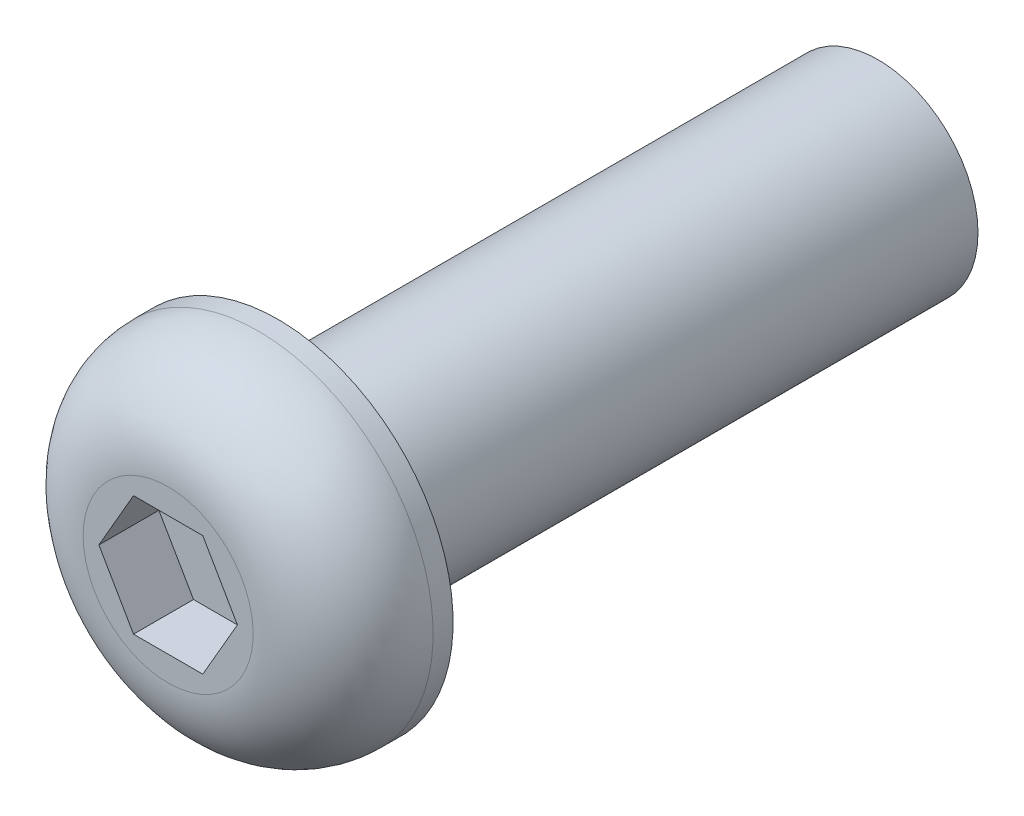
from build123d import *

# Parameters (mm, degrees)
SKETCH1_R          = 5
EXTRUDE1_DEPTH     = 30
CUT_EXTRUDE1_DEPTH = 3


with BuildPart() as part:
    # Sketch1 → Extrude1 (new body)
    with BuildSketch(Plane.XY):
        Circle(SKETCH1_R)
    extrude(amount=-EXTRUDE1_DEPTH)

    # Sketch2 → Revolve1 (revolve)
    with BuildSketch(Plane(origin=(0, 0, 0), x_dir=(0, 0, -1), z_dir=(1, 0, 0)), mode=Mode.PRIVATE) as revolve1_sk:
        with BuildLine():
            Line((0, 0), (0, 8.75))
            Line((0, 8.75), (-1, 8.75))
            ThreePointArc((-1, 8.75), (-4.181980515, 7.431980515), (-5.5, 4.25))
            Line((-5.5, 4.25), (-5.5, 0))
            Line((-5.5, 0), (0, 0))
        make_face()
    revolve(revolve1_sk.sketch.rotate(Axis((0, 0, 0), (0, 0, 1)), 90), axis=Axis((0, 0, 0), (0, 0, 1)))

    # Sketch3 → Cut-Extrude1 (cut)
    with BuildSketch(Plane.XY.offset(5.5)):
        Polygon((-1.732050808, 3), (-3.464101615, 0), (-1.732050808, -3), (1.732050808, -3), (3.464101615, 0), (1.732050808, 3), align=None)
    extrude(amount=-CUT_EXTRUDE1_DEPTH, mode=Mode.SUBTRACT)


solid = part.part
